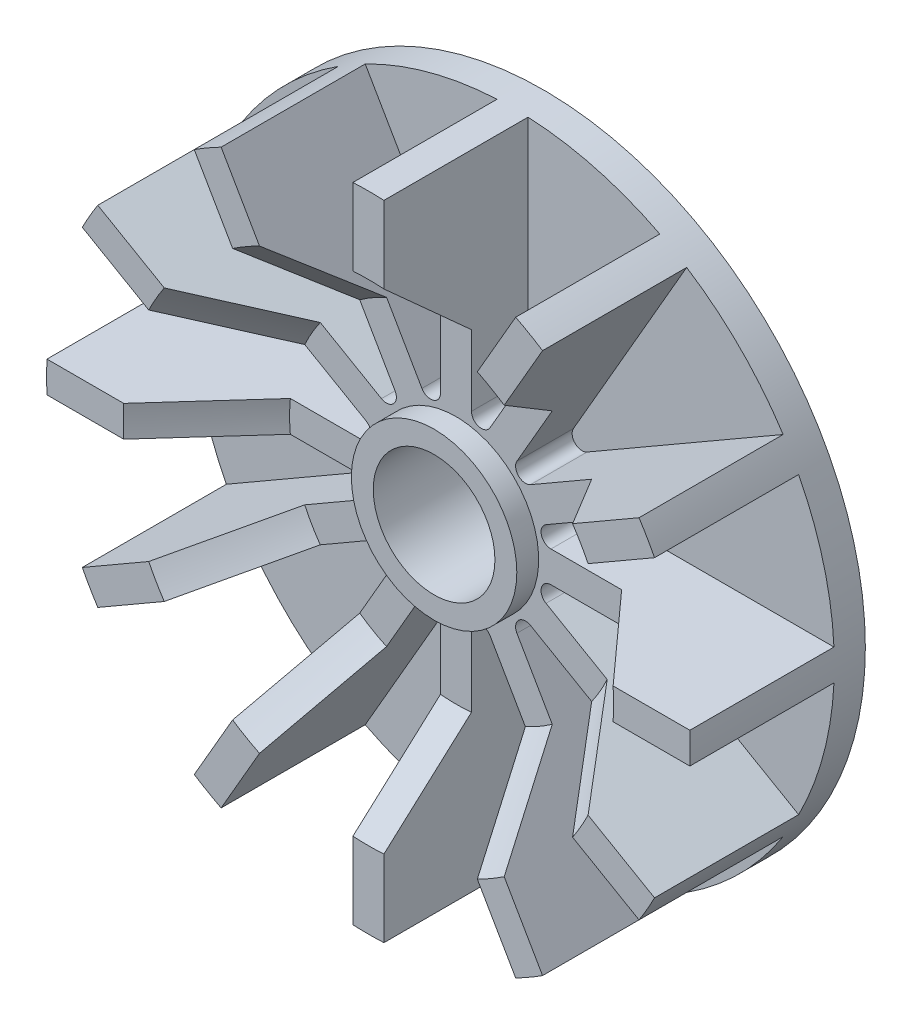
from build123d import *

# Parameters (mm, degrees)
SKETCH1_R           = 46.6725
BOSS_EXTRUDE1_DEPTH = 4.5
BOSS_EXTRUDE2_START = -4.5
BOSS_EXTRUDE2_DEPTH = 25.4
SKETCH4_R           = 11.9975
SKETCH4_R_2         = 8.8225
BOSS_EXTRUDE3_DEPTH = 3.175


with BuildPart() as part:
    # Sketch1 → Boss-Extrude1 (new body)
    with BuildSketch(Plane.XY):
        Circle(SKETCH1_R)
        with BuildLine():
            Line((-2.927883194, 8.3225), (2.927883194, 8.3225))
            ThreePointArc((2.927883194, 8.3225), (0, -8.8225), (-2.927883194, 8.3225))
        make_face(mode=Mode.SUBTRACT)
    extrude(amount=BOSS_EXTRUDE1_DEPTH)

    # Sketch2 → Boss-Extrude2 (add)
    with BuildSketch(Plane.XY.offset(4.5).offset(BOSS_EXTRUDE2_START)):
        with BuildLine():
            Line((-2.25, 46.618234161), (-2.25, 13.778350254))
            ThreePointArc((-2.25, 13.778350254), (-3.318707206, 12.385583908), (-4.940617969, 13.057401343))
            Line((-4.940617969, 13.057401343), (-21.360559922, 41.497575063))
            ThreePointArc((-21.360559922, 41.497575063), (-23.33625, 40.419570658), (-25.257674239, 39.247575063))
            Line((-25.257674239, 39.247575063), (-8.837732286, 10.807401343))
            ThreePointArc((-8.837732286, 10.807401343), (-9.066876702, 9.066876702), (-10.807401343, 8.837732286))
            Line((-10.807401343, 8.837732286), (-39.247575063, 25.257674239))
            ThreePointArc((-39.247575063, 25.257674239), (-40.419570658, 23.33625), (-41.497575063, 21.360559922))
            Line((-41.497575063, 21.360559922), (-13.057401343, 4.940617969))
            ThreePointArc((-13.057401343, 4.940617969), (-12.385583908, 3.318707206), (-13.778350254, 2.25))
            Line((-13.778350254, 2.25), (-46.618234161, 2.25))
            ThreePointArc((-46.618234161, 2.25), (-46.6725, 0), (-46.618234161, -2.25))
            Line((-46.618234161, -2.25), (-13.778350254, -2.25))
            ThreePointArc((-13.778350254, -2.25), (-12.385583908, -3.318707206), (-13.057401343, -4.940617969))
            Line((-13.057401343, -4.940617969), (-41.497575063, -21.360559922))
            ThreePointArc((-41.497575063, -21.360559922), (-40.419570658, -23.33625), (-39.247575063, -25.257674239))
            Line((-39.247575063, -25.257674239), (-10.807401343, -8.837732286))
            ThreePointArc((-10.807401343, -8.837732286), (-9.066876702, -9.066876702), (-8.837732286, -10.807401343))
            Line((-8.837732286, -10.807401343), (-25.257674239, -39.247575063))
            ThreePointArc((-25.257674239, -39.247575063), (-23.33625, -40.419570658), (-21.360559922, -41.497575063))
            Line((-21.360559922, -41.497575063), (-4.940617969, -13.057401343))
            ThreePointArc((-4.940617969, -13.057401343), (-3.318707206, -12.385583908), (-2.25, -13.778350254))
            Line((-2.25, -13.778350254), (-2.25, -46.618234161))
            ThreePointArc((-2.25, -46.618234161), (0, -46.6725), (2.25, -46.618234161))
            Line((2.25, -46.618234161), (2.25, -13.778350254))
            ThreePointArc((2.25, -13.778350254), (3.318707206, -12.385583908), (4.940617969, -13.057401343))
            Line((4.940617969, -13.057401343), (21.360559922, -41.497575063))
            ThreePointArc((21.360559922, -41.497575063), (23.33625, -40.419570658), (25.257674239, -39.247575063))
            Line((25.257674239, -39.247575063), (8.837732286, -10.807401343))
            ThreePointArc((8.837732286, -10.807401343), (9.066876702, -9.066876702), (10.807401343, -8.837732286))
            Line((10.807401343, -8.837732286), (39.247575063, -25.257674239))
            ThreePointArc((39.247575063, -25.257674239), (40.419570658, -23.33625), (41.497575063, -21.360559922))
            Line((41.497575063, -21.360559922), (13.057401343, -4.940617969))
            ThreePointArc((13.057401343, -4.940617969), (12.385583908, -3.318707206), (13.778350254, -2.25))
            Line((13.778350254, -2.25), (46.618234161, -2.25))
            ThreePointArc((46.618234161, -2.25), (46.6725, 0), (46.618234161, 2.25))
            Line((46.618234161, 2.25), (13.778350254, 2.25))
            ThreePointArc((13.778350254, 2.25), (12.385583908, 3.318707206), (13.057401343, 4.940617969))
            Line((13.057401343, 4.940617969), (41.497575063, 21.360559922))
            ThreePointArc((41.497575063, 21.360559922), (40.419570658, 23.33625), (39.247575063, 25.257674239))
            Line((39.247575063, 25.257674239), (10.807401343, 8.837732286))
            ThreePointArc((10.807401343, 8.837732286), (9.066876702, 9.066876702), (8.837732286, 10.807401343))
            Line((8.837732286, 10.807401343), (25.257674239, 39.247575063))
            ThreePointArc((25.257674239, 39.247575063), (23.33625, 40.419570658), (21.360559922, 41.497575063))
            Line((21.360559922, 41.497575063), (4.940617969, 13.057401343))
            ThreePointArc((4.940617969, 13.057401343), (3.318707206, 12.385583908), (2.25, 13.778350254))
            Line((2.25, 13.778350254), (2.25, 46.618234161))
            ThreePointArc((2.25, 46.618234161), (0, 46.6725), (-2.25, 46.618234161))
        make_face()
        with BuildLine():
            Line((2.927883194, 8.3225), (-2.927883194, 8.3225))
            ThreePointArc((-2.927883194, 8.3225), (0, -8.8225), (2.927883194, 8.3225))
        make_face(mode=Mode.SUBTRACT)
    extrude(amount=BOSS_EXTRUDE2_DEPTH)

    # Sketch3 → Cut-Revolve1 (revolve, cut)
    with BuildSketch(Plane(origin=(0, 0, 0), x_dir=(1, 0, 0), z_dir=(0, 1, 0)), mode=Mode.PRIVATE) as cut_revolve1_sk:
        Polygon((-24.13, -12.7), (-6.35, -12.7), (-6.35, -25.4), (-35.56, -25.4), align=None)
    revolve(cut_revolve1_sk.sketch.rotate(Axis((0, 0, 0), (0, 0, 1)), 2.76320082), axis=Axis((0, 0, 0), (0, 0, 1)), mode=Mode.SUBTRACT)

    # Sketch4 → Boss-Extrude3 (add)
    with BuildSketch(Plane.XY.offset(12.7)):
        with Locations(Location((0, 0, 0), (0, 0, 180))):
            Circle(SKETCH4_R)
        with Locations(Location((0, 0, 0), (0, 0, 109.382041685))):
            Circle(SKETCH4_R_2, mode=Mode.SUBTRACT)
    extrude(amount=BOSS_EXTRUDE3_DEPTH)


solid = part.part
